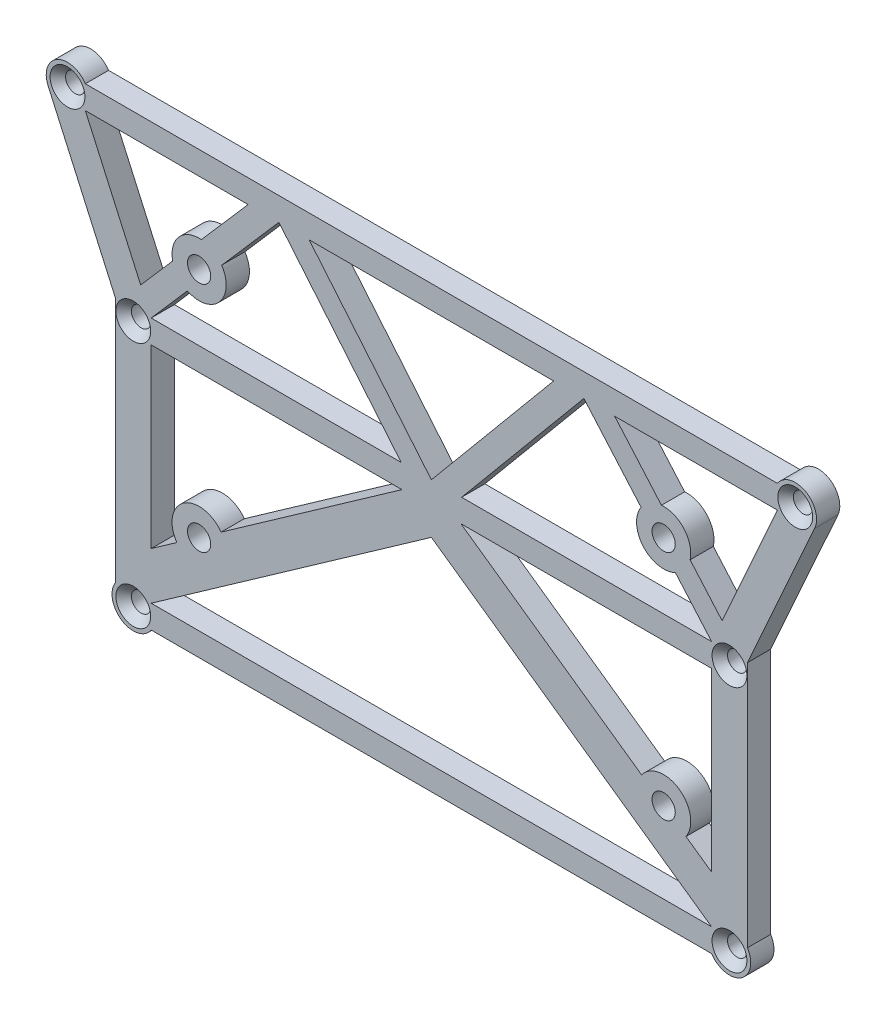
from build123d import *

# Parameters (mm, degrees)
SKETCH1_R           = 1.25
BOSS_EXTRUDE1_DEPTH = 3
CHAMFER1_SIZE       = 1
SKETCH2_R           = 3.5
BOSS_EXTRUDE2_DEPTH = 3
SKETCH2_3_R         = 1.5
CUT_EXTRUDE1_DEPTH  = 3


with BuildPart() as part:
    # Sketch1 → Boss-Extrude1 (new body)
    with BuildSketch(Plane.XY):
        with BuildLine():
            Line((6.173773471, 33.368208058), (-2.509184891, 52.727938114))
            ThreePointArc((-2.509184891, 52.727938114), (-1.316660917, 56.267635348), (2.304886114, 55.353323017))
            Line((2.304886114, 55.353323017), (91.695113886, 55.353323017))
            ThreePointArc((91.695113886, 55.353323017), (95.316660917, 56.267635348), (96.509184891, 52.727938114))
            Line((96.509184891, 52.727938114), (87.826226529, 33.368208058))
            Line((87.826226529, 33.368208058), (87.826226529, 1.466686789))
            ThreePointArc((87.826226529, 1.466686789), (86.983381771, -2.315616229), (83.195113886, -1.5))
            Line((83.195113886, -1.5), (10.804886114, -1.5))
            ThreePointArc((10.804886114, -1.5), (7.016618229, -2.315616229), (6.173773471, 1.466686789))
            Line((6.173773471, 1.466686789), (6.173773471, 33.368208058))
        make_face()
        with Locations((0, 53.853323017)):
            Circle(SKETCH1_R, mode=Mode.SUBTRACT)
        with Locations((8.5, 31.901521269)):
            Circle(SKETCH1_R, mode=Mode.SUBTRACT)
        with Locations((8.5, 0)):
            Circle(SKETCH1_R, mode=Mode.SUBTRACT)
        with Locations(Location((85.5, 0, 0), (0, 0, 180))):
            Circle(SKETCH1_R, mode=Mode.SUBTRACT)
        with Locations(Location((85.5, 31.901521269, 0), (0, 0, 180))):
            Circle(SKETCH1_R, mode=Mode.SUBTRACT)
        with Locations(Location((94, 53.853323017, 0), (0, 0, 180))):
            Circle(SKETCH1_R, mode=Mode.SUBTRACT)
        Polygon((9.452473834, 36.416891788), (2.304886114, 52.353323017), (23.327202938, 52.353323017), align=None, mode=Mode.SUBTRACT)
        Polygon((10.804886114, 33.401521269), (43.095167668, 33.401521269), (27.304886114, 52.353323017), align=None, mode=Mode.SUBTRACT)
        Polygon((10.804886114, 30.401521269), (43.196670996, 30.401521269), (10.804886114, 7.613376738), align=None, mode=Mode.SUBTRACT)
        Polygon((10.804886114, 1.5), (83.195113886, 1.5), (47, 26.963847996), align=None, mode=Mode.SUBTRACT)
        Polygon((83.195113886, 30.401521269), (83.195113886, 7.613376738), (50.803329004, 30.401521269), align=None, mode=Mode.SUBTRACT)
        Polygon((84.547526166, 36.416891788), (91.695113886, 52.353323017), (70.672797062, 52.353323017), align=None, mode=Mode.SUBTRACT)
        Polygon((47, 33.401521269), (31.209718446, 52.353323017), (62.790281554, 52.353323017), align=None, mode=Mode.SUBTRACT)
        Polygon((50.904832332, 33.401521269), (83.195113886, 33.401521269), (66.695113886, 52.353323017), align=None, mode=Mode.SUBTRACT)
    extrude(amount=BOSS_EXTRUDE1_DEPTH)

    # Chamfer1
    chamfer1_edges = [part.edges().sort_by_distance(p)[0] for p in [
        (86.75, 0, 3),
        (86.75, 31.901521269, 3),
        (95.25, 53.853323017, 3),
        (-1.25, 53.853323017, 3),
        (7.25, 31.901521269, 3),
        (7.25, 0, 3),
    ]]
    chamfer(chamfer1_edges, length=CHAMFER1_SIZE)

    # Sketch2 → Boss-Extrude2 (add)
    with BuildSketch(Plane.XY.offset(3)):
        with Locations((17, 41.926661509)):
            Circle(SKETCH2_R)
        with Locations((17, 11.926661509)):
            Circle(SKETCH2_R)
        with Locations((77, 41.926661509)):
            Circle(SKETCH2_R)
        with Locations((77, 11.926661509)):
            Circle(SKETCH2_R)
    extrude(amount=-BOSS_EXTRUDE2_DEPTH)

    # Sketch2<3> → Cut-Extrude1 (cut)
    with BuildSketch(Plane.XY.offset(3)):
        with Locations((17, 11.926661509)):
            Circle(SKETCH2_3_R)
        with Locations((77, 11.926661509)):
            Circle(SKETCH2_3_R)
        with Locations((17, 41.926661509)):
            Circle(SKETCH2_3_R)
        with Locations((77, 41.926661509)):
            Circle(SKETCH2_3_R)
    extrude(amount=-CUT_EXTRUDE1_DEPTH, mode=Mode.SUBTRACT)


solid = part.part
